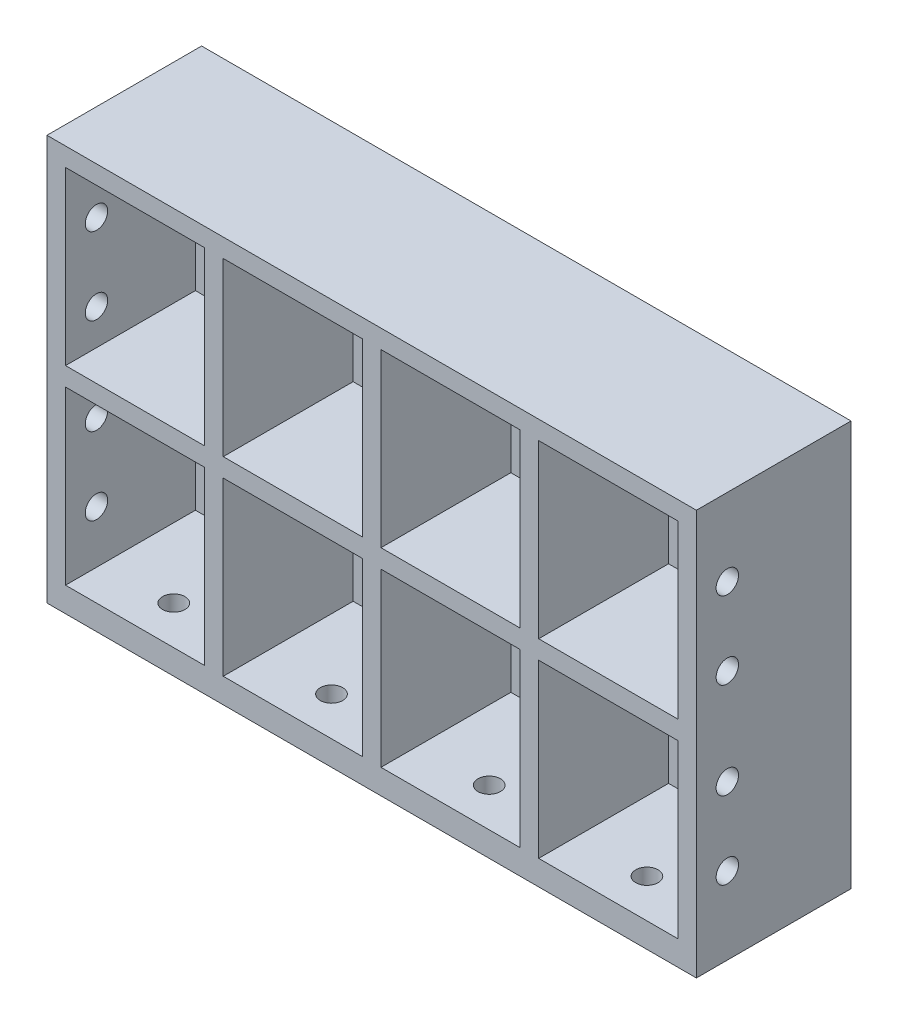
from build123d import *

# Parameters (mm, degrees)
SKETCH1_W           = 420
SKETCH1_H           = 100
BOSS_EXTRUDE1_DEPTH = 16
SKETCH2_W           = 420
SKETCH2_H           = 246
BOSS_EXTRUDE2_DEPTH = 16
SKETCH3_W           = 420
SKETCH3_H           = 12
SKETCH3_W_2         = 12
SKETCH3_H_2         = 111
SKETCH3_H_3         = 111.25908774
BOSS_EXTRUDE3_DEPTH = 100
SKETCH4_R           = 7.25
CUT_EXTRUDE3_DEPTH  = 16
SKETCH5_R           = 7.25
CUT_EXTRUDE4_DEPTH  = 26


with BuildPart() as part:
    # Sketch1 → Boss-Extrude1 (new body)
    with BuildSketch(Plane(origin=(0, 0, 0), x_dir=(1, 0, 0), z_dir=(0, 1, 0))):
        with Locations((0, -50)):
            Rectangle(SKETCH1_W, SKETCH1_H)
    extrude(amount=BOSS_EXTRUDE1_DEPTH)

    # Sketch2 → Boss-Extrude2 (add)
    with BuildSketch(Plane.XY):
        with Locations((0, 139)):
            Rectangle(SKETCH2_W, SKETCH2_H)
    extrude(amount=BOSS_EXTRUDE2_DEPTH)

    # Sketch3 → Boss-Extrude3 (add)
    with BuildSketch(Plane.XY):
        with Locations((0, 256)):
            Rectangle(SKETCH3_W, SKETCH3_H)
        with Locations((-204, 194.5)):
            Rectangle(SKETCH3_W_2, SKETCH3_H_2)
        with Locations((-102, 194.5)):
            Rectangle(SKETCH3_W_2, SKETCH3_H_2)
        with Locations((0, 194.5)):
            Rectangle(SKETCH3_W_2, SKETCH3_H_2)
        with Locations((0, 133)):
            Rectangle(SKETCH3_W, SKETCH3_H)
        with Locations((-204, 71.5)):
            Rectangle(SKETCH3_W_2, SKETCH3_H_2)
        with Locations((-102, 71.37045613)):
            Rectangle(SKETCH3_W_2, SKETCH3_H_3)
        with Locations((204, 71.5)):
            Rectangle(SKETCH3_W_2, SKETCH3_H_2)
        with Locations((204, 194.5)):
            Rectangle(SKETCH3_W_2, SKETCH3_H_2)
        with Locations((0, 71.5)):
            Rectangle(SKETCH3_W_2, SKETCH3_H_2)
        with Locations((102, 194.5)):
            Rectangle(SKETCH3_W_2, SKETCH3_H_2)
        with Locations((102, 71.5)):
            Rectangle(SKETCH3_W_2, SKETCH3_H_2)
    extrude(amount=BOSS_EXTRUDE3_DEPTH)

    # Sketch4 → Cut-Extrude3 (cut)
    with BuildSketch(Plane(origin=(0, 0, 0), x_dir=(1, 0, 0), z_dir=(0, 1, 0))):
        with Locations(Location((-153, -75, 0), (0, 0, 270))):
            Circle(SKETCH4_R)
        with Locations(Location((-51, -75, 0), (0, 0, 270))):
            Circle(SKETCH4_R)
        with Locations(Location((51, -75, 0), (0, 0, 270))):
            Circle(SKETCH4_R)
        with Locations(Location((153, -75, 0), (0, 0, 270))):
            Circle(SKETCH4_R)
    extrude(amount=CUT_EXTRUDE3_DEPTH, mode=Mode.SUBTRACT)

    # Sketch5 → Cut-Extrude4 (cut)
    with BuildSketch(Plane.ZY.offset(-198)):
        with Locations((80, 212)):
            Circle(SKETCH5_R)
        with Locations((80, 162)):
            Circle(SKETCH5_R)
        with Locations((80, 100)):
            Circle(SKETCH5_R)
        with Locations((80, 50)):
            Circle(SKETCH5_R)
    cut_extrude4 = extrude(amount=-CUT_EXTRUDE4_DEPTH, mode=Mode.SUBTRACT)

    # Mirror1: Cut-Extrude4 across plane
    add(cut_extrude4.mirror(Plane(origin=(0, 0, 0), x_dir=(0, 0, 1), z_dir=(1, 0, 0))), mode=Mode.SUBTRACT)


solid = part.part
